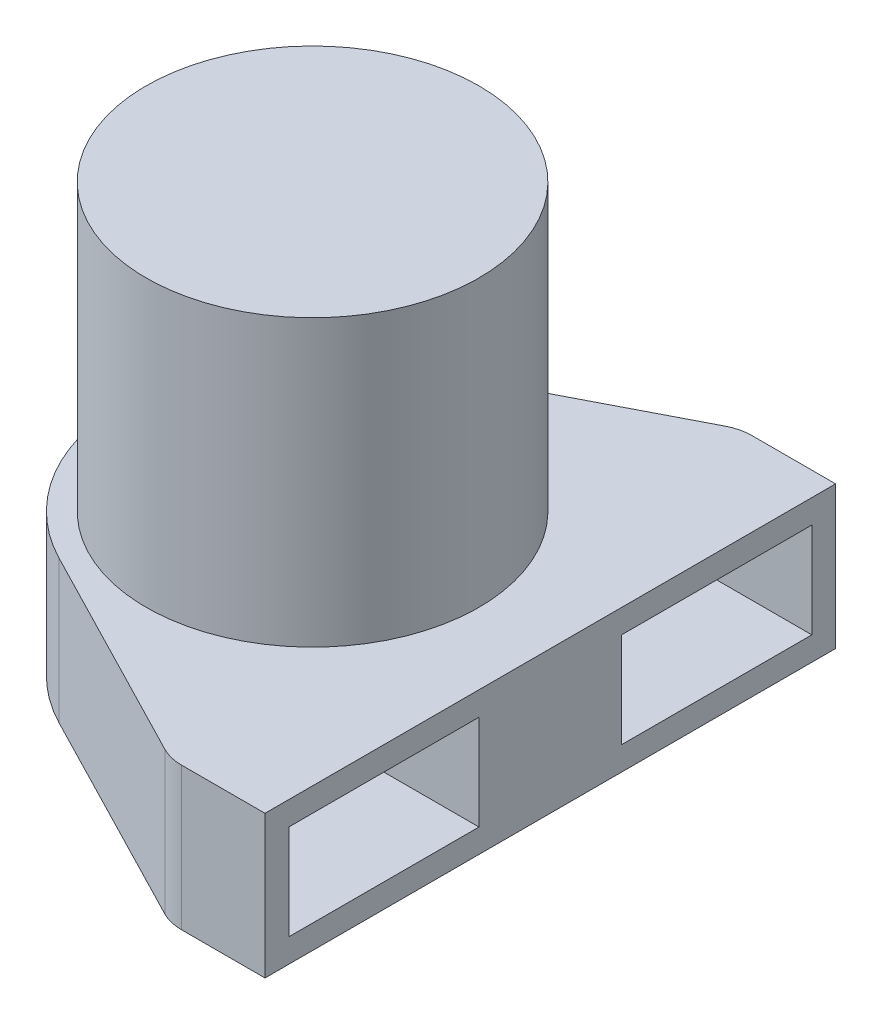
from build123d import *

# Parameters (mm, degrees)
CROQUIS1_R              = 35
SALIENTE_EXTRUIR1_DEPTH = 90
SALIENTE_EXTRUIR2_DEPTH = 30
CROQUIS3_W              = 40
CROQUIS3_H              = 20
CORTAR_EXTRUIR1_DEPTH   = 28


with BuildPart() as part:
    # Croquis1 → Saliente-Extruir1 (new body)
    with BuildSketch(Plane(origin=(0, 0, 0), x_dir=(1, 0, 0), z_dir=(0, 1, 0))):
        with Locations(Location((0, 0, 0), (0, 0, 90))):
            Circle(CROQUIS1_R)
    extrude(amount=SALIENTE_EXTRUIR1_DEPTH)

    # Croquis2 → Saliente-Extruir2 (add)
    with BuildSketch(Plane.XZ):
        with BuildLine():
            Line((50, 60), (50, -60))
            Line((50, -60), (32.42606327, -60))
            ThreePointArc((32.42606327, -60), (30.068391754, -59.718095751), (27.843647762, -58.888277005))
            Line((27.843647762, -58.888277005), (-18.138307464, -35.181947356))
            ThreePointArc((-18.138307464, -35.181947356), (-39.582415507, 0), (-18.138307464, 35.181947356))
            Line((-18.138307464, 35.181947356), (27.843647762, 58.888277005))
            ThreePointArc((27.843647762, 58.888277005), (30.068391754, 59.718095751), (32.42606327, 60))
            Line((32.42606327, 60), (50, 60))
        make_face()
    extrude(amount=-SALIENTE_EXTRUIR2_DEPTH)

    # Croquis3 → Cortar-Extruir1 (cut)
    with BuildSketch(Plane(origin=(50, 0, 0), x_dir=(0, 0, -1), z_dir=(1, 0, 0))):
        with Locations((-35, 15)):
            Rectangle(CROQUIS3_W, CROQUIS3_H)
        with Locations((35, 15)):
            Rectangle(CROQUIS3_W, CROQUIS3_H)
    extrude(amount=-CORTAR_EXTRUIR1_DEPTH, mode=Mode.SUBTRACT)


solid = part.part
